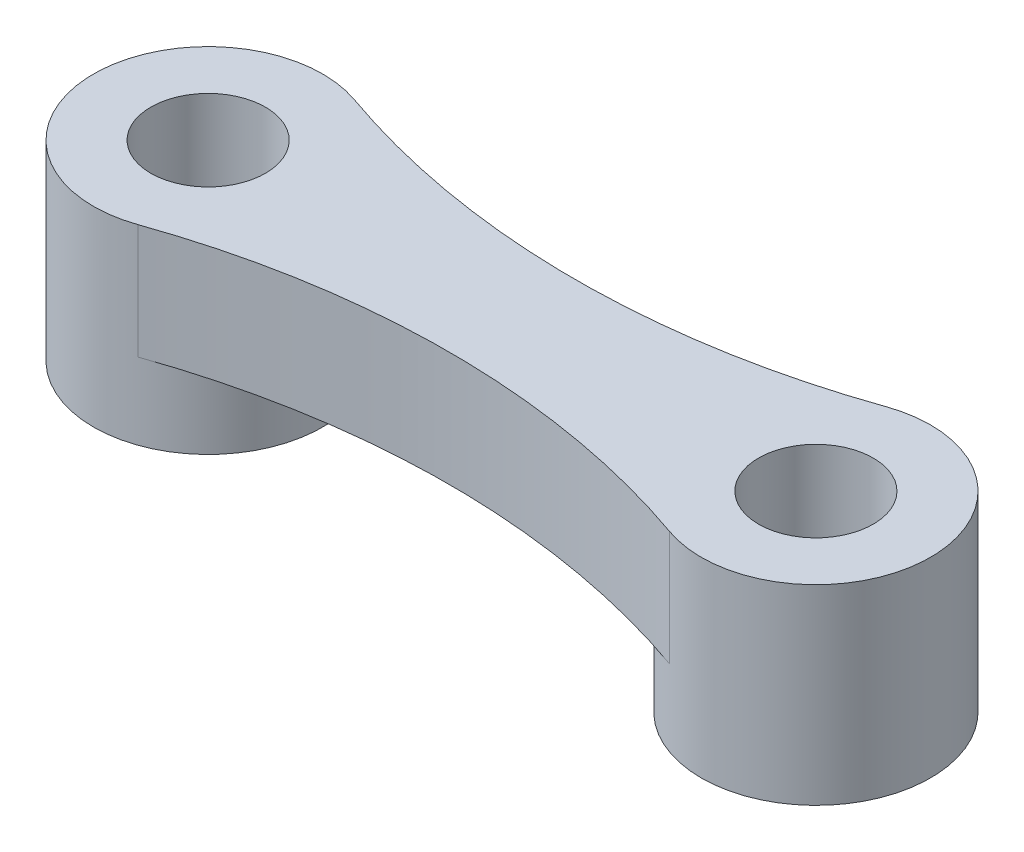
from build123d import *
from build123d.topology import SkipClean

# Parameters (mm, degrees)
SKETCH1_R           = 1.5
BOSS_EXTRUDE1_DEPTH = 3
SKETCH2_OUTSIDE_W   = 28.48
SKETCH2_OUTSIDE_H   = 12.58
CUT_EXTRUDE1_DEPTH  = 12.743189516
BOSS_EXTRUDE2_START = -3
SKETCH3_R           = 1.5
BOSS_EXTRUDE2_DEPTH = 2


with BuildPart() as part:
    # Sketch1 → Boss-Extrude1 (new body)
    with BuildSketch(Plane(origin=(0, 0, 0), x_dir=(1, 0, 0), z_dir=(0, 1, 0))):
        with BuildLine():
            Line((-7.95, 3), (7.95, 3))
            ThreePointArc((7.95, 3), (10.95, 0), (7.95, -3))
            Line((7.95, -3), (-7.95, -3))
            ThreePointArc((-7.95, -3), (-10.95, 0), (-7.95, 3))
        make_face()
        with Locations(Location((-7.95, 0, 0), (0, 0, 270))):
            Circle(SKETCH1_R, mode=Mode.SUBTRACT)
        with Locations(Location((7.95, 0, 0), (0, 0, 270))):
            Circle(SKETCH1_R, mode=Mode.SUBTRACT)
    extrude(amount=BOSS_EXTRUDE1_DEPTH)

    # Sketch2 outside → Cut-Extrude1 (cut, through all)
    with SkipClean():  # the faces are left unmerged after this step: merging them gives an invalid solid
        with BuildSketch(Plane(origin=(0, 3, 0), x_dir=(1, 0, 0), z_dir=(0, 1, 0))):
            Rectangle(SKETCH2_OUTSIDE_W, SKETCH2_OUTSIDE_H)
            with BuildLine():
                ThreePointArc((-6.95625, 2.830629071), (-10.95, 0), (-6.95625, -2.830629071))
                ThreePointArc((-6.95625, -2.830629071), (0, -1.645032568), (6.95625, -2.830629071))
                ThreePointArc((6.95625, -2.830629071), (10.95, 0), (6.95625, 2.830629071))
                ThreePointArc((6.95625, 2.830629071), (0, 1.645032568), (-6.95625, 2.830629071))
            make_face(mode=Mode.SUBTRACT)
        extrude(amount=-CUT_EXTRUDE1_DEPTH, mode=Mode.SUBTRACT)

    # Sketch3 → Boss-Extrude2 (add)
    # profile 1 of 2: a face of its own
    with SkipClean():  # the faces are left unmerged after this step: merging them gives an invalid solid
        with BuildSketch(Plane(origin=(0, 3, 0), x_dir=(1, 0, 0), z_dir=(0, 1, 0)).offset(BOSS_EXTRUDE2_START)):
            with BuildLine():
                ThreePointArc((-6.95625, -2.830629071), (-5.502424669, -1.734755026), (-4.95, 0))
                ThreePointArc((-4.95, 0), (-5.502424669, 1.734755026), (-6.95625, 2.830629071))
                ThreePointArc((-6.95625, 2.830629071), (-10.95, 0), (-6.95625, -2.830629071))
            make_face()
            with Locations(Location((-7.95, 0, 0), (0, 0, 270))):
                Circle(SKETCH3_R, mode=Mode.SUBTRACT)
        # profile 2 of 2: a face of its own
        with BuildSketch(Plane(origin=(0, 3, 0), x_dir=(1, 0, 0), z_dir=(0, 1, 0)).offset(BOSS_EXTRUDE2_START)):
            with BuildLine():
                ThreePointArc((6.95625, -2.830629071), (9.684755026, -2.447575331), (10.95, 0))
                ThreePointArc((10.95, 0), (9.684755026, 2.447575331), (6.95625, 2.830629071))
                ThreePointArc((6.95625, 2.830629071), (4.95, 0), (6.95625, -2.830629071))
            make_face()
            with Locations(Location((7.95, 0, 0), (0, 0, 270))):
                Circle(SKETCH3_R, mode=Mode.SUBTRACT)
        extrude(amount=-BOSS_EXTRUDE2_DEPTH)


solid = part.part
